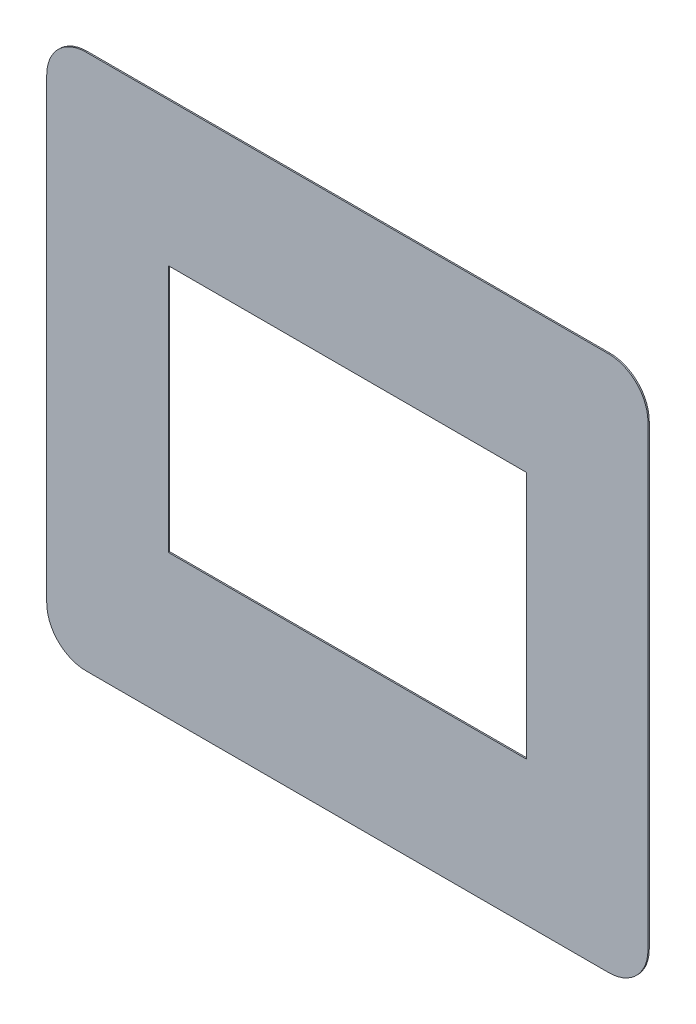
from build123d import *

# Parameters (mm, degrees)
RESSALTO_EXTRUS_O1_DEPTH   = 0.1
CORTE_EXTRUS_O1_DEPTH      = 33.458434448
CORTE_EXTRUS_O1_DEPTH_BACK = 33.458434448
ESBO_O2_W                  = 27.4
ESBO_O2_H                  = 19


with BuildPart() as part:
    # Esboço1 → Ressalto-extrusão1 (new body)
    with BuildSketch(Plane.XY):
        with BuildLine():
            Line((-22.158193819, 19.025172981), (-22.158193819, -15.974827019))
            ThreePointArc((-22.158193819, -15.974827019), (-21.279514162, -18.096147362), (-19.158193819, -18.974827019))
            Line((-19.158193819, -18.974827019), (20.841806181, -18.974827019))
            ThreePointArc((20.841806181, -18.974827019), (22.963126525, -18.096147362), (23.841806181, -15.974827019))
            Line((23.841806181, -15.974827019), (23.841806181, 19.025172981))
            ThreePointArc((23.841806181, 19.025172981), (22.963126525, 21.146493325), (20.841806181, 22.025172981))
            Line((20.841806181, 22.025172981), (-19.158193819, 22.025172981))
            ThreePointArc((-19.158193819, 22.025172981), (-21.279514162, 21.146493325), (-22.158193819, 19.025172981))
        make_face()
    extrude(amount=RESSALTO_EXTRUS_O1_DEPTH)

    # Esboço2 → Corte-extrusão1 (cut, two sides: drawn at the far end of the back side and taken through both)
    with BuildSketch(Plane(origin=(0, 0, 0), x_dir=(-1, 0, 0), z_dir=(0, 0, -1)).offset(-CORTE_EXTRUS_O1_DEPTH_BACK)):
        with Locations((-0.841806181, 1.525172981)):
            Rectangle(ESBO_O2_W, ESBO_O2_H)
    extrude(amount=CORTE_EXTRUS_O1_DEPTH + CORTE_EXTRUS_O1_DEPTH_BACK, mode=Mode.SUBTRACT)


solid = part.part
